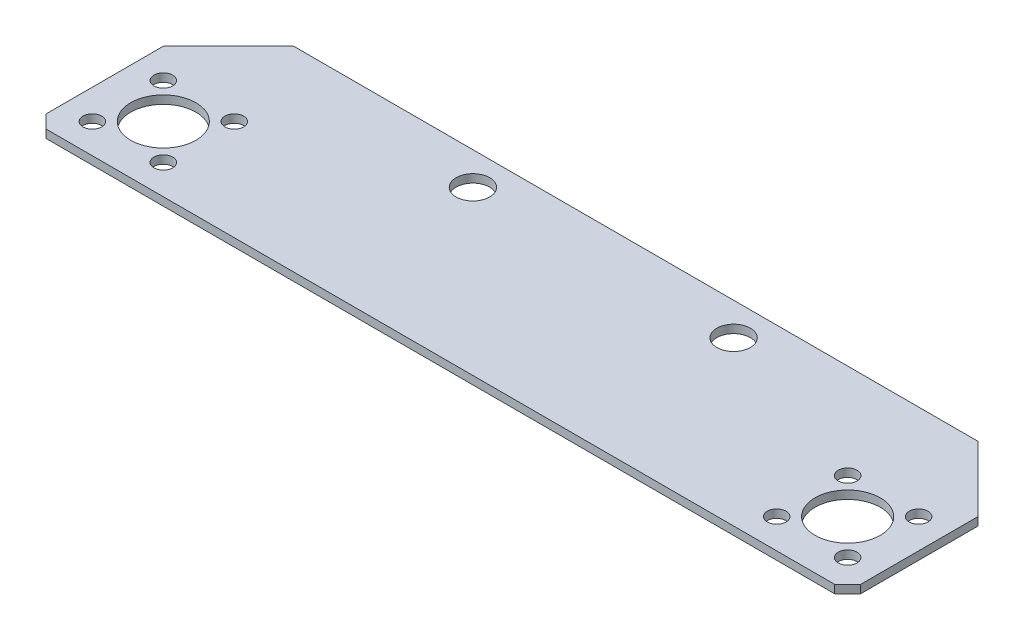
from build123d import *

# Parameters (mm, degrees)
SKETCH1_W                   = 158.75
SKETCH1_H                   = 38.1
BOSS_EXTRUDE1_DEPTH         = 1.6002
F_27_0_144_DIAMETER_HOLE1_D = 3.6576
F_1_2_0_5_DIAMETER_HOLE1_D  = 12.7
F_0_257_DIAMETER_HOLE1_D    = 6.5278
CHAMFER1_SIZE               = 2.54
CHAMFER2_SIZE               = 12.7


with BuildPart() as part:
    # Sketch1 → Boss-Extrude1 (new body)
    with BuildSketch(Plane(origin=(0, 0, 0), x_dir=(1, 0, 0), z_dir=(0, 1, 0))):
        with Locations((79.375, 19.05)):
            Rectangle(SKETCH1_W, SKETCH1_H)
    extrude(amount=BOSS_EXTRUDE1_DEPTH)

    # #27 (0.144) Diameter Hole1 (through all)
    with Locations(Plane(origin=(0, 1.6002, 0), x_dir=(1, 0, 0), z_dir=(0, 1, 0))):
        with Locations((5.785202787, 19.614797213), (19.614797213, 5.785202787), (5.785202787, 5.785202787), (19.614797213, 19.614797213), (152.964797213, 5.785202787), (139.135202787, 5.785202787), (139.135202787, 19.614797213), (152.964797213, 19.614797213)):
            Hole(F_27_0_144_DIAMETER_HOLE1_D / 2)

    # 1/2 (0.5) Diameter Hole1 (through all)
    with Locations(Plane(origin=(0, 1.6002, 0), x_dir=(1, 0, 0), z_dir=(0, 1, 0))):
        with Locations((12.7, 12.7), (146.05, 12.7)):
            Hole(F_1_2_0_5_DIAMETER_HOLE1_D / 2)

    # F (0.257) Diameter Hole1 (through all)
    with Locations(Plane(origin=(0, 1.6002, 0), x_dir=(1, 0, 0), z_dir=(0, 1, 0))):
        with Locations((53.975, 31.75), (104.775, 31.75)):
            Hole(F_0_257_DIAMETER_HOLE1_D / 2)

    # Chamfer1
    chamfer1_edges = [part.edges().sort_by_distance(p)[0] for p in [
        (158.75, 0.8001, 0),
        (0, 0.8001, 0),
    ]]
    chamfer(chamfer1_edges, length=CHAMFER1_SIZE)

    # Chamfer2
    chamfer2_edges = [part.edges().sort_by_distance(p)[0] for p in [
        (0, 0.8001, -38.1),
        (158.75, 0.8001, -38.1),
    ]]
    chamfer(chamfer2_edges, length=CHAMFER2_SIZE)


solid = part.part
